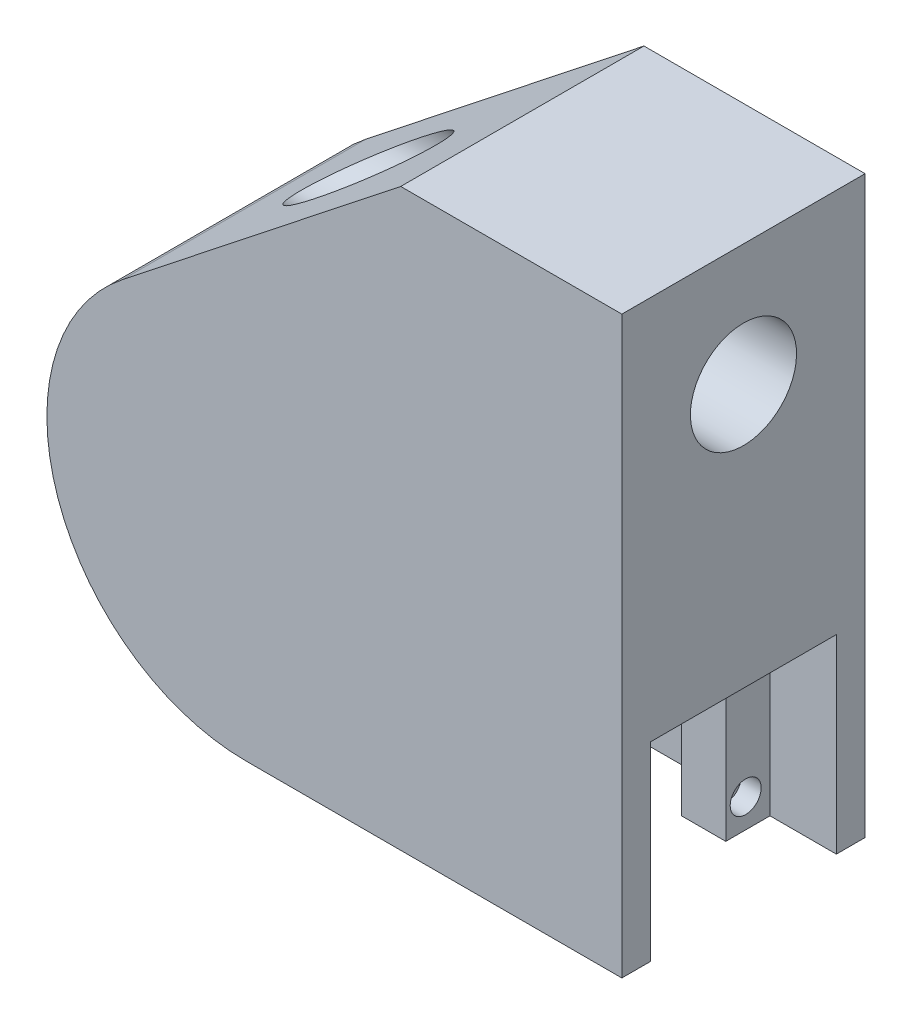
from build123d import *

# Parameters (mm, degrees)
SKIZZE1_W                       = 50
SKIZZE1_H                       = 50
SKIZZE1_R                       = 45
AUFSATZ_LINEAR_AUSTRAGEN2_DEPTH = 55
SCHNITT_LINEAR_AUSTRAGEN1_DEPTH = 43
SKIZZE4_R                       = 1.5
SCHNITT_LINEAR_AUSTRAGEN2_DEPTH = 10
SKIZZE5_R                       = 3.5
SCHNITT_LINEAR_AUSTRAGEN3_DEPTH = 4.5
SCHNITT_LINEAR_AUSTRAGEN4_DEPTH = 21
SCHNITT_LINEAR_START            = -6
SKIZZE7_R                       = 13
SCHNITT_LINEAR_AUSTRAGEN5_DEPTH = 49
SKIZZE8_R                       = 12
SCHNITT_LINEAR_AUSTRAGEN6_DEPTH = 165.772570533
SKIZZE9_R                       = 1.65
SCHNITT_LINEAR_AUSTRAGEN9_DEPTH = 20


with BuildPart() as part:
    # Skizze1 → Aufsatz-Linear austragen2 (new body)
    with BuildSketch(Plane.XY):
        with BuildLine():
            Line((35, 35), (35, 85))
            Line((35, 85), (-27.896103401, 35.310160224))
            ThreePointArc((-27.896103401, 35.310160224), (19.617279971, 40.498917597), (45, 0))
            ThreePointArc((45, 0), (31.819805153, -31.819805153), (0, -45))
            Line((0, -45), (85, -45))
            Line((85, -45), (85, 35))
            Line((85, 35), (35, 35))
        make_face()
        with Locations((60, 60)):
            Rectangle(SKIZZE1_W, SKIZZE1_H)
        Circle(SKIZZE1_R)
    extrude(amount=AUFSATZ_LINEAR_AUSTRAGEN2_DEPTH)

    # Skizze3 → Schnitt-Linear austragen1 (cut)
    with BuildSketch(Plane.XZ.offset(45)):
        Polygon((60, 48.5), (19, 48.5), (19, 6.5), (60, 6.5), (60, 16.5), (70, 16.5), (70, 6.5), (85, 6.5), (85, 48.5), (70, 48.5), (70, 38.5), (60, 38.5), align=None)
    extrude(amount=-SCHNITT_LINEAR_AUSTRAGEN1_DEPTH, mode=Mode.SUBTRACT)

    # Skizze4 → Schnitt-Linear austragen2 (cut)
    with BuildSketch(Plane(origin=(70, 0, 0), x_dir=(0, 0, -1), z_dir=(1, 0, 0))):
        with Locations(Location((-42.999780644, -7.500219356, 0), (0, 0, 90))):
            Circle(SKIZZE4_R)
        with Locations(Location((-12.000219356, -7.500219356, 0), (0, 0, 90))):
            Circle(SKIZZE4_R)
        with Locations(Location((-12.000219356, -38.499780644, 0), (0, 0, 90))):
            Circle(SKIZZE4_R)
        with BuildLine():
            ThreePointArc((-41.499780644, -38.499780644), (-42.402127924, -37.123985882), (-44.023528946, -37.403450669))
            ThreePointArc((-44.023528946, -37.403450669), (-42.999780644, -38.499780644), (-41.903450669, -39.523528946))
            ThreePointArc((-41.903450669, -39.523528946), (-41.604342547, -39.050010158), (-41.499780644, -38.499780644))
        make_face()
        with BuildLine():
            ThreePointArc((-41.903450669, -39.523528946), (-42.999780644, -38.499780644), (-44.023528946, -37.403450669))
            ThreePointArc((-44.023528946, -37.403450669), (-44.060440815, -39.560440815), (-41.903450669, -39.523528946))
        make_face()
    extrude(amount=-SCHNITT_LINEAR_AUSTRAGEN2_DEPTH, mode=Mode.SUBTRACT)

    # Skizze5 → Schnitt-Linear austragen3 (cut)
    with BuildSketch(Plane(origin=(70, 0, 0), x_dir=(0, 0, -1), z_dir=(1, 0, 0))):
        with Locations(Location((-42.999780644, -7.500219356, 0), (0, 0, 90))):
            Circle(SKIZZE5_R)
        with Locations(Location((-12.000219356, -7.500219356, 0), (0, 0, 90))):
            Circle(SKIZZE5_R)
        with Locations(Location((-12.000219356, -38.499780644, 0), (0, 0, 90))):
            Circle(SKIZZE5_R)
        with Locations(Location((-42.999780644, -38.499780644, 0), (0, 0, 90))):
            Circle(SKIZZE5_R)
    extrude(amount=-SCHNITT_LINEAR_AUSTRAGEN3_DEPTH, mode=Mode.SUBTRACT)

    # Skizze6 → Schnitt-Linear austragen4 (cut, symmetric)
    with BuildSketch(Plane.XY.offset(27.5)):
        Polygon((29, 10.5), (19, 10.5), (19, 3), (19, -2), (29, -2), align=None)
        with BuildLine():
            Line((19, 3), (19, 10.5))
            Line((19, 10.5), (5.809475019, 10.5))
            ThreePointArc((5.809475019, 10.5), (9.486832981, 7.348469228), (11.618950039, 3))
            Line((11.618950039, 3), (19, 3))
        make_face()
    extrude(amount=SCHNITT_LINEAR_AUSTRAGEN4_DEPTH, both=True, mode=Mode.SUBTRACT)

    # Skizze7 → Schnitt-Linear austragen5 (cut)
    with BuildSketch(Plane.XY.offset(55).offset(SCHNITT_LINEAR_START)):
        Circle(SKIZZE7_R)
    extrude(amount=-SCHNITT_LINEAR_AUSTRAGEN5_DEPTH, mode=Mode.SUBTRACT)

    # Skizze8 → Schnitt-Linear austragen6 (cut, through all)
    with BuildSketch(Plane(origin=(85, 0, 0), x_dir=(0, 0, -1), z_dir=(1, 0, 0))):
        with Locations(Location((-27.5, 57.5, 0), (0, 0, 90))):
            Circle(SKIZZE8_R)
    extrude(amount=-SCHNITT_LINEAR_AUSTRAGEN6_DEPTH, mode=Mode.SUBTRACT)

    # Skizze9 → Schnitt-Linear austragen9 (cut)
    with BuildSketch(Plane(origin=(0, 0, 0), x_dir=(-1, 0, 0), z_dir=(0, 0, -1))):
        with Locations((-10.037587636, 14.335160775)):
            Circle(SKIZZE9_R)
        with Locations((14.335160775, 10.037587636)):
            Circle(SKIZZE9_R)
        with Locations((10.037587636, -14.335160775)):
            Circle(SKIZZE9_R)
        with Locations((-14.335160775, -10.037587636)):
            Circle(SKIZZE9_R)
    extrude(amount=-SCHNITT_LINEAR_AUSTRAGEN9_DEPTH, mode=Mode.SUBTRACT)


solid = part.part
